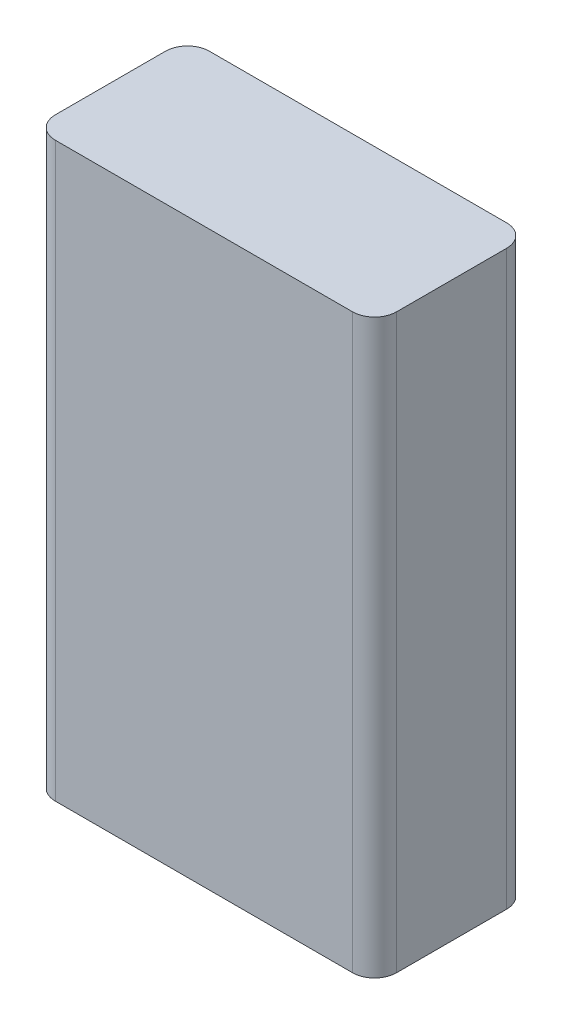
from build123d import *

# Parameters (mm, degrees)
SKETCH1_W           = 31
SKETCH1_H           = 52
BOSS_EXTRUDE1_DEPTH = 14
FILLET1_R           = 2


with BuildPart() as part:
    # Sketch1 → Boss-Extrude1 (new body)
    with BuildSketch(Plane.XY):
        Rectangle(SKETCH1_W, SKETCH1_H)
    extrude(amount=-BOSS_EXTRUDE1_DEPTH)

    # Fillet1
    fillet1_edges = [part.edges().sort_by_distance(p)[0] for p in [
        (15.5, 0, -14),
        (-15.5, 0, -14),
        (15.5, 0, 0),
        (-15.5, 0, 0),
    ]]
    fillet(fillet1_edges, radius=FILLET1_R)


solid = part.part
